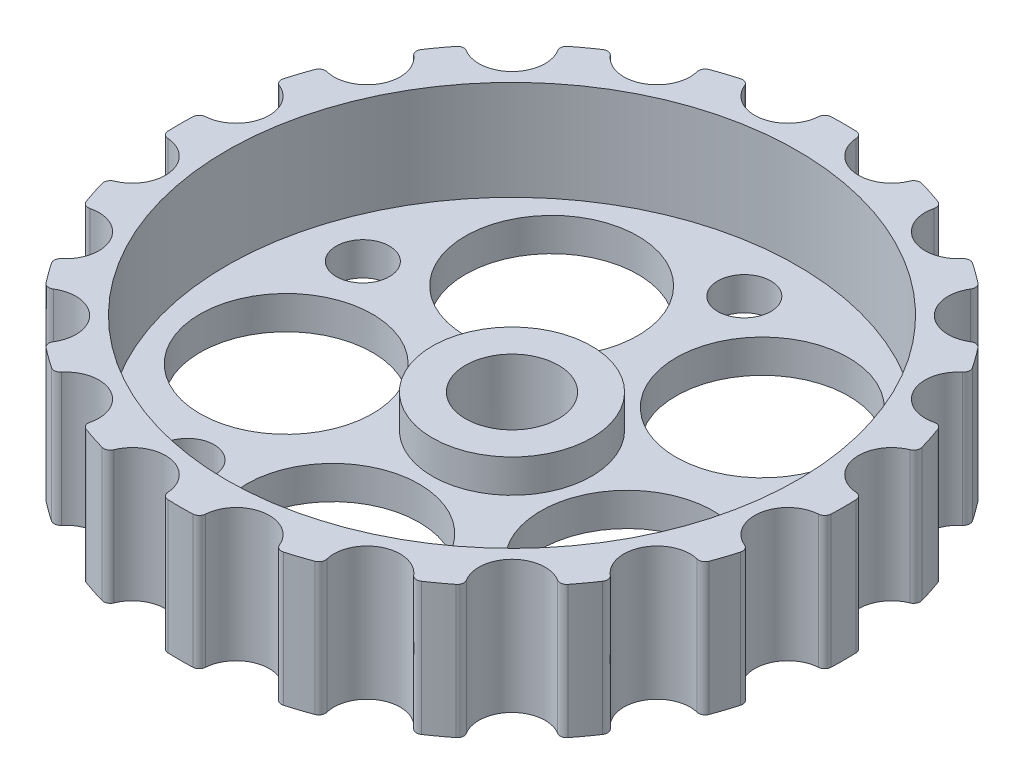
from build123d import *

# Parameters (mm, degrees)
SKETCH_1_W                       = 50
SKETCH_1_H                       = 20
SKETCH_3_W                       = 5
SKETCH_3_H                       = 20
FILLET_1_R                       = 1
PATTERN_CIRCULAR_1_COUNT         = 20
FILLET_1_OF_PATTERN_CIRCULAR_1_R = 1
SKETCH_6_W                       = 13
SKETCH_6_H                       = 20
SKETCH_7_R                       = 7
CUT_EXTRUDE_1_DEPTH              = 74.484692447
PATTERN_CIRCULAR_2_COUNT         = 5
SKETCH_8_W                       = 4
SKETCH_8_H                       = 20
PATTERN_CIRCULAR_3_COUNT         = 5


with BuildPart() as part:
    # Эскиз1 → Повернуть1 (revolve)
    with BuildSketch(Plane.XY, mode=Mode.PRIVATE) as revolve_1_sk:
        with Locations((25, 0)):
            Rectangle(SKETCH_1_W, SKETCH_1_H)
    revolve(revolve_1_sk.sketch.rotate(Axis((0, -10, 0), (0, 1, 0)), 90), axis=Axis((0, -10, 0), (0, 1, 0)))

    # Эскиз3 → Вырез-Повернуть1 (revolve, cut)
    with BuildSketch(Plane(origin=(0, 0, 0), x_dir=(0.7071067811865435, 0, -0.7071067811865517), z_dir=(0.7071067811865517, 0, 0.7071067811865435))):
        with Locations((52.5, 0)):
            Rectangle(SKETCH_3_W, SKETCH_3_H)
    cut_revolve_1 = revolve(axis=Axis((35.355339059, 10, -35.355339059), (0, -1, 0)), mode=Mode.SUBTRACT)

    # Эскиз4 → Вырез-Повернуть4 (revolve, cut)
    with BuildSketch(Plane(origin=(0, 0, 0), x_dir=(0, 0, -1), z_dir=(1, 0, 0)), mode=Mode.PRIVATE) as cut_revolve_4_sk:
        Polygon((0, 10), (0, 0), (12, 0), (12, -5), (43, -5), (43, 10), align=None)
    revolve(cut_revolve_4_sk.sketch.rotate(Axis((0, 10, 0), (0, -1, 0)), 180), axis=Axis((0, 10, 0), (0, -1, 0)), mode=Mode.SUBTRACT)

    # Скругление1
    fillet_1_edges = [part.edges().sort_by_distance(p)[0] for p in [
        (38.709674087, 0, -31.647450641),
        (31.647450641, 0, -38.709674087),
    ]]
    fillet(fillet_1_edges, radius=FILLET_1_R)

    # Круговой массив1: Вырез-Повернуть1 ×20 about axis
    pattern_circular_1_axis = Axis((0, 0, 0), (0, 1, 0))
    for i in range(1, PATTERN_CIRCULAR_1_COUNT):
        add(cut_revolve_1.rotate(pattern_circular_1_axis, i * 360 / PATTERN_CIRCULAR_1_COUNT), mode=Mode.SUBTRACT)

    # Скругление1 of Круговой массив1
    fillet_1_of_pattern_circular_1_edges = [part.edges().sort_by_distance(p)[0] for p in [
        (27.035487707, 0, -42.060461296),
        (18.136567017, 0, -46.594687861),
        (12.714879424, 0, -48.356300947),
        (2.850349848, 0, -49.918688943),
        (-2.850349848, 0, -49.918688943),
        (-12.714879424, 0, -48.356300947),
        (-18.136567017, 0, -46.594687861),
        (-27.035487707, 0, -42.060461296),
        (-31.647450641, 0, -38.709674087),
        (-38.709674087, 0, -31.647450641),
        (-42.060461296, 0, -27.035487707),
        (-46.594687861, 0, -18.136567017),
        (-48.356300947, 0, -12.714879424),
        (-49.918688943, 0, -2.850349848),
        (-49.918688943, 0, 2.850349848),
        (-48.356300947, 0, 12.714879424),
        (-46.594687861, 0, 18.136567017),
        (-42.060461296, 0, 27.035487707),
        (-38.709674087, 0, 31.647450641),
        (-31.647450641, 0, 38.709674087),
        (-27.035487707, 0, 42.060461296),
        (-18.136567017, 0, 46.594687861),
        (-12.714879424, 0, 48.356300947),
        (-2.850349848, 0, 49.918688943),
        (2.850349848, 0, 49.918688943),
        (12.714879424, 0, 48.356300947),
        (18.136567017, 0, 46.594687861),
        (27.035487707, 0, 42.060461296),
        (31.647450641, 0, 38.709674087),
        (38.709674087, 0, 31.647450641),
        (42.060461296, 0, 27.035487707),
        (46.594687861, 0, 18.136567017),
        (48.356300947, 0, 12.714879424),
        (49.918688943, 0, 2.850349848),
        (49.918688943, 0, -2.850349848),
        (48.356300947, 0, -12.714879424),
        (46.594687861, 0, -18.136567017),
        (42.060461296, 0, -27.035487707),
    ]]
    fillet(fillet_1_of_pattern_circular_1_edges, radius=FILLET_1_OF_PATTERN_CIRCULAR_1_R)

    # Эскиз6 → Вырез-Повернуть5 (revolve, cut)
    with BuildSketch(Plane(origin=(0, 0, 0), x_dir=(0, 0, -1), z_dir=(1, 0, 0)), mode=Mode.PRIVATE) as cut_revolve_5_sk:
        with Locations((-33.5, 0)):
            Rectangle(SKETCH_6_W, SKETCH_6_H)
    cut_revolve_5 = revolve(cut_revolve_5_sk.sketch.rotate(Axis((0, -10, 27), (0, 1, 0)), 180), axis=Axis((0, -10, 27), (0, 1, 0)), mode=Mode.SUBTRACT)

    # Эскиз7 → Вырез-Вытянуть1 (cut, through all)
    with BuildSketch(Plane.XZ.offset(10)):
        with Locations(Location((0, 0, 0), (0, 0, 270))):
            Circle(SKETCH_7_R)
    extrude(amount=-CUT_EXTRUDE_1_DEPTH, mode=Mode.SUBTRACT)

    # Круговой массив2: Вырез-Повернуть5 ×5 about axis
    pattern_circular_2_axis = Axis((0, 0, 0), (0, 1, 0))
    for i in range(1, PATTERN_CIRCULAR_2_COUNT):
        add(cut_revolve_5.rotate(pattern_circular_2_axis, i * 360 / PATTERN_CIRCULAR_2_COUNT), mode=Mode.SUBTRACT)

    # Эскиз8 → Вырез-Повернуть6 (revolve, cut)
    with BuildSketch(Plane(origin=(0, 0, 0), x_dir=(0, 0, -1), z_dir=(1, 0, 0))):
        with Locations((37, 0)):
            Rectangle(SKETCH_8_W, SKETCH_8_H)
    cut_revolve_6 = revolve(axis=Axis((0, -10, -35), (0, 1, 0)), mode=Mode.SUBTRACT)

    # Круговой массив3: Вырез-Повернуть6 ×5 about axis
    pattern_circular_3_axis = Axis((0, 0, 0), (0, 1, 0))
    for i in range(1, PATTERN_CIRCULAR_3_COUNT):
        add(cut_revolve_6.rotate(pattern_circular_3_axis, i * 360 / PATTERN_CIRCULAR_3_COUNT), mode=Mode.SUBTRACT)


solid = part.part
